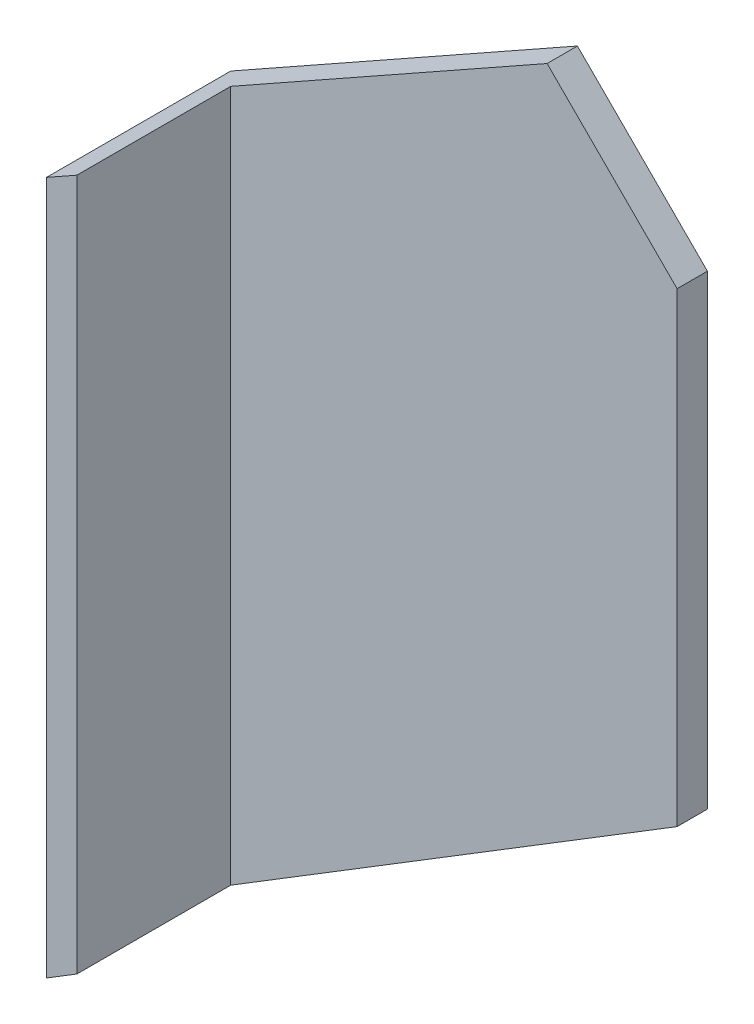
from build123d import *

# Parameters (mm, degrees)
EXTRUDE_1_DEPTH = 14
EXTRUDE_2_DEPTH = 71


with BuildPart() as part:
    # 草图1 → 凸台-拉伸1 (new body)
    with BuildSketch(Plane.XY):
        Polygon((-119.656440364, -63.376666372), (-119.656440364, 256.623333628), (40.343559636, 346.623333628), (100.343559636, 286.623333628), (100.343559636, 71.623333628), align=None)
    extrude(amount=EXTRUDE_1_DEPTH)

    # 草图3 → 凸台-拉伸2 (add)
    with BuildSketch(Plane.XY.offset(14)):
        Polygon((-105.656440364, 264.498333628), (-105.656440364, -54.785757281), (-119.656440364, -63.376666372), (-119.656440364, 256.623333628), align=None)
    extrude(amount=EXTRUDE_2_DEPTH)


solid = part.part
